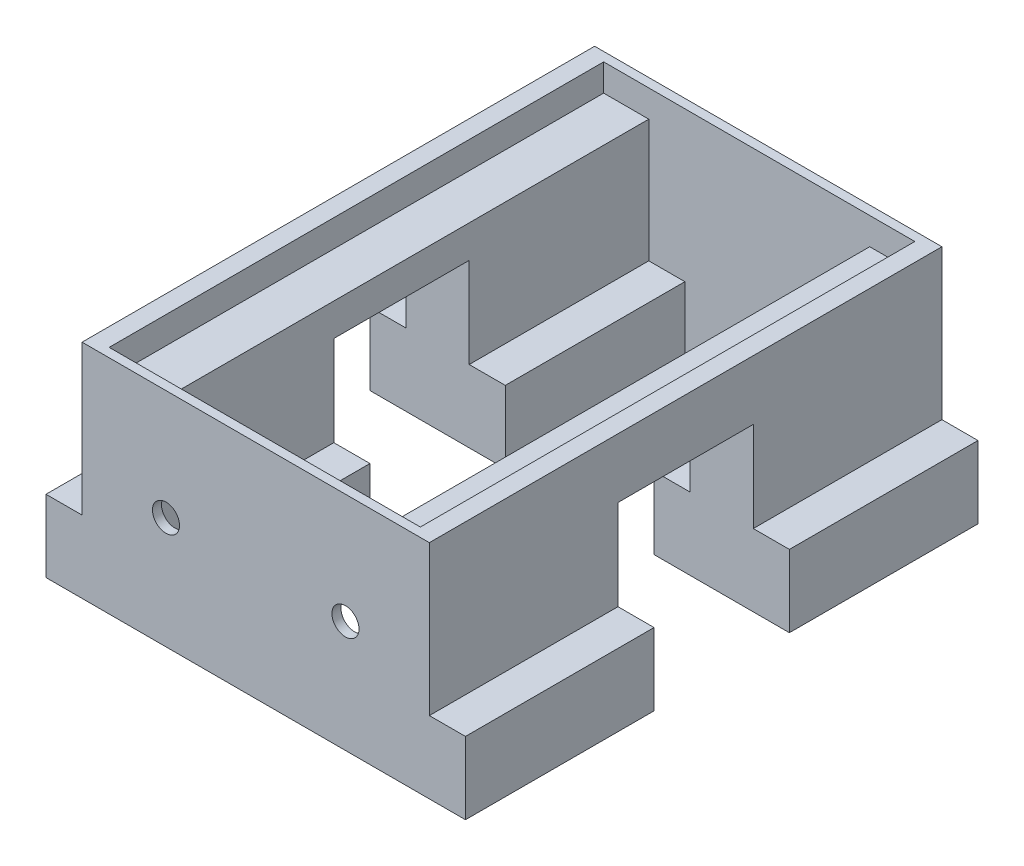
from build123d import *

# Parameters (mm, degrees)
BOSS_EXTRUDE1_DEPTH   = 274.05
BOSS_EXTRUDE1_2_DEPTH = 274.05
BOSS_EXTRUDE2_DEPTH   = 5
BOSS_EXTRUDE3_DEPTH   = 5
SKETCH4_W             = 75
SKETCH4_H             = 90
CUT_EXTRUDE4_DEPTH    = 300
SKETCH5_R             = 7.5
CUT_EXTRUDE5_DEPTH    = 10


with BuildPart() as part:
    # Sketch1 → Boss-Extrude1 (new body)
    with BuildSketch(Plane.XY):
        Polygon((-41.225, 0), (-41.225, 40), (-61.225, 40), (-61.225, 108), (-86.225, 108), (-86.225, 123), (-96.225, 123), (-96.225, 40), (-116.225, 40), (-116.225, 0), align=None)
    extrude(amount=BOSS_EXTRUDE1_DEPTH)



with BuildPart() as body_2:
    # Sketch1 → Boss-Extrude1 2 (new body)
    with BuildSketch(Plane.XY):
        Polygon((116.225, 0), (41.225, 0), (41.225, 40), (61.225, 40), (61.225, 108), (86.225, 108), (86.225, 123), (96.225, 123), (96.225, 40), (116.225, 40), align=None)
    extrude(amount=BOSS_EXTRUDE1_2_DEPTH)


with BuildPart() as part_1:
    add(part.part)

    add(body_2.part)  # Boss-Extrude2 merges body 2
    # Sketch2 → Boss-Extrude2 (add)
    with BuildSketch(Plane.XY.offset(274.05)):
        Polygon((-96.225, 123), (96.225, 123), (96.225, 40), (116.225, 40), (116.225, 0), (-116.225, 0), (-116.225, 40), (-96.225, 40), align=None)
    extrude(amount=BOSS_EXTRUDE2_DEPTH)

    # Sketch3 → Boss-Extrude3 (add)
    with BuildSketch(Plane(origin=(0, 0, 0), x_dir=(-1, 0, 0), z_dir=(0, 0, -1))):
        Polygon((-96.225, 123), (96.225, 123), (96.225, 40), (116.225, 40), (116.225, 0), (-116.225, 0), (-116.225, 40), (-96.225, 40), align=None)
    extrude(amount=BOSS_EXTRUDE3_DEPTH)

    # Sketch4 → Cut-Extrude4 (cut)
    with BuildSketch(Plane(origin=(116.225, 0, 0), x_dir=(0, 0, -1), z_dir=(1, 0, 0))):
        with Locations((-137.025, 45)):
            Rectangle(SKETCH4_W, SKETCH4_H)
    extrude(amount=-CUT_EXTRUDE4_DEPTH, mode=Mode.SUBTRACT)

    # Sketch5 → Cut-Extrude5 (cut)
    with BuildSketch(Plane.XY.offset(279.05)):
        with Locations((-49.725, 62)):
            Circle(SKETCH5_R)
        with Locations(Location((49.725, 62, 0), (0, 0, 180))):
            Circle(SKETCH5_R)
    extrude(amount=-CUT_EXTRUDE5_DEPTH, mode=Mode.SUBTRACT)


solid = part_1.part
